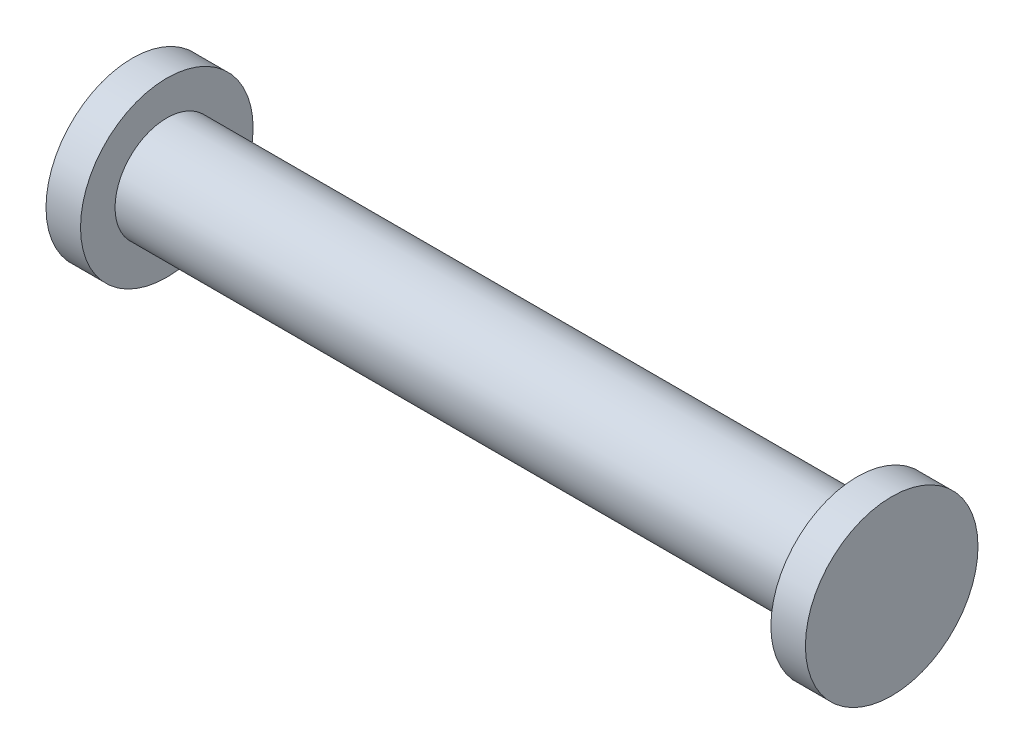
from build123d import *

# Parameters (mm, degrees)
SKETCH3_W   = 69.85
SKETCH3_H   = 4.7625
SKETCH3_W_2 = 3.175
SKETCH3_H_2 = 3.175


with BuildPart() as part:
    # Sketch3 → Revolve1 (revolve)
    with BuildSketch(Plane.XY, mode=Mode.PRIVATE) as revolve1_sk:
        with Locations((34.925, 2.38125)):
            Rectangle(SKETCH3_W, SKETCH3_H)
        with Locations((1.5875, 6.35)):
            Rectangle(SKETCH3_W_2, SKETCH3_H_2)
        with Locations((68.2625, 6.35)):
            Rectangle(SKETCH3_W_2, SKETCH3_H_2)
    revolve(revolve1_sk.sketch.rotate(Axis((0, 0, 0), (1, 0, 0)), 90), axis=Axis((0, 0, 0), (1, 0, 0)))


solid = part.part
